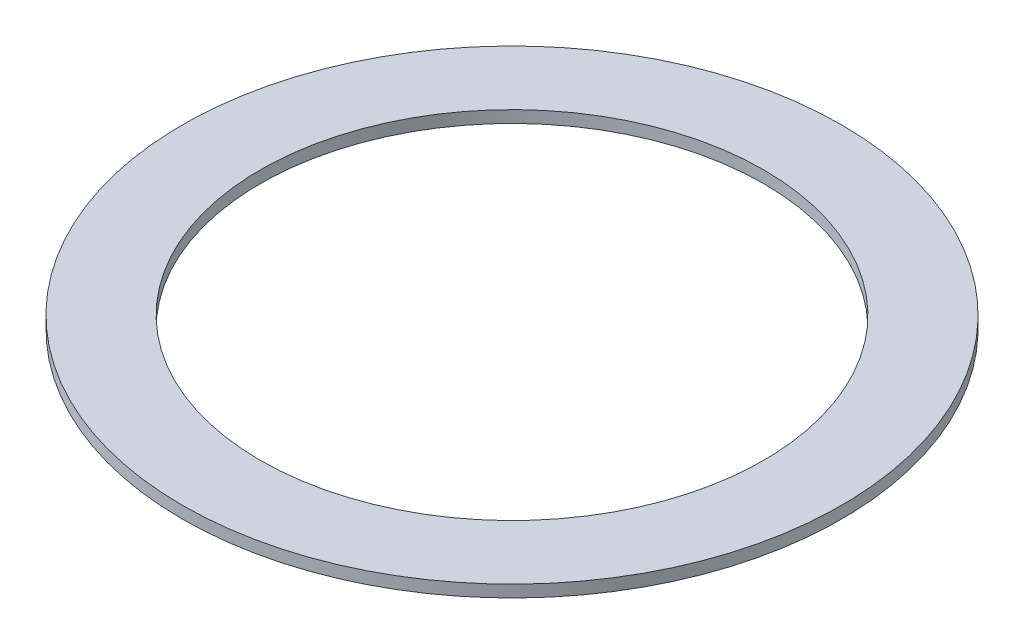
from build123d import *

# Parameters (mm, degrees)
SKETCH1_R           = 27.5
SKETCH1_R_2         = 21
BOSS_EXTRUDE1_DEPTH = 1


with BuildPart() as part:
    # Sketch1 → Boss-Extrude1 (new body)
    with BuildSketch(Plane(origin=(0, 0, 0), x_dir=(1, 0, 0), z_dir=(0, 1, 0))):
        with Locations(Location((0, 0, 0), (0, 0, 270))):
            Circle(SKETCH1_R)
        with Locations(Location((0, 0, 0), (0, 0, 270))):
            Circle(SKETCH1_R_2, mode=Mode.SUBTRACT)
    extrude(amount=BOSS_EXTRUDE1_DEPTH)


solid = part.part
